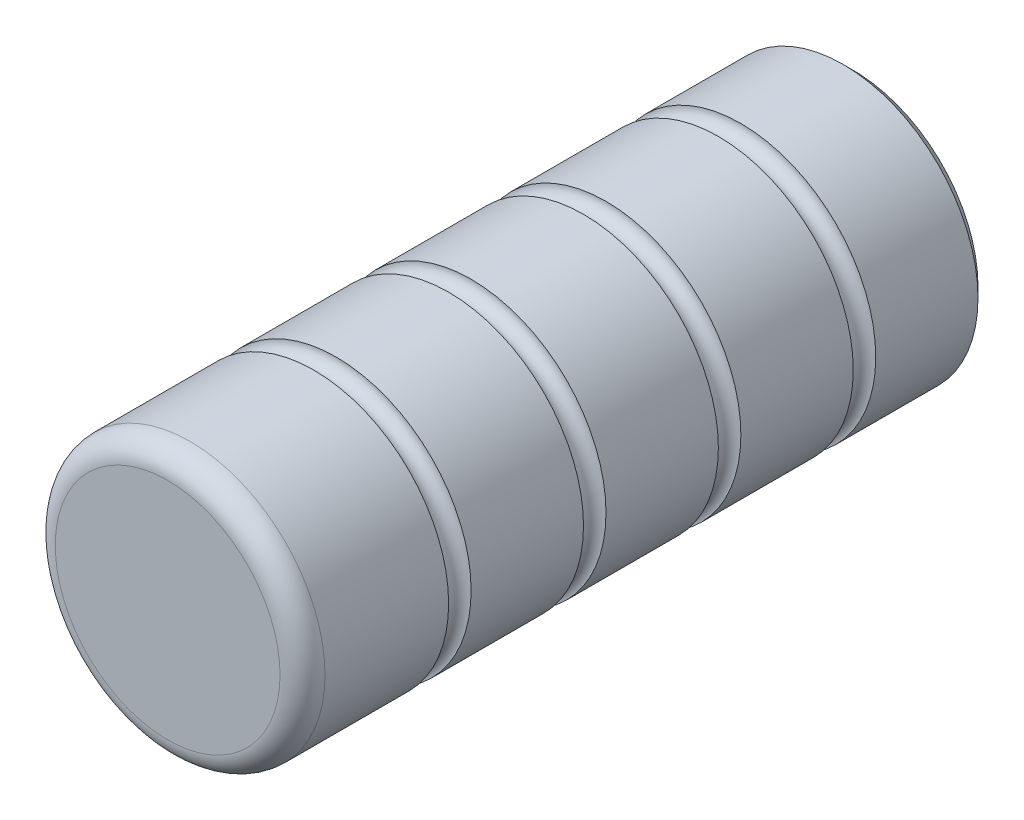
from build123d import *

# Parameters (mm, degrees)
ESBO_O1_R                = 6
RESSALTO_EXTRUS_O1_DEPTH = 30.5
ESBO_O2_R                = 3.175
CORTE_EXTRUS_O1_DEPTH    = 10
FILETE1_R                = 1
ESBO_O3_R                = 0.5
CHANFRO1_SIZE            = 0.45


with BuildPart() as part:
    # Esboço1 → Ressalto-extrusão1 (new body)
    with BuildSketch(Plane.XY):
        with Locations(Location((0, 0, 0), (0, 0, 180))):
            Circle(ESBO_O1_R)
    extrude(amount=RESSALTO_EXTRUS_O1_DEPTH)

    # Esboço2 → Corte-extrusão1 (cut)
    with BuildSketch(Plane(origin=(0, 0, 0), x_dir=(-1, 0, 0), z_dir=(0, 0, -1))):
        Circle(ESBO_O2_R)
    extrude(amount=-CORTE_EXTRUS_O1_DEPTH, mode=Mode.SUBTRACT)

    # Filete1
    filete1_edges = [part.edges().sort_by_distance(p)[0] for p in [
        (6, 0, 30.5),
    ]]
    fillet(filete1_edges, radius=FILETE1_R)

    # Esboço3 → Corte-Revolução1 (revolve, cut)
    with BuildSketch(Plane(origin=(0, 0, 0), x_dir=(1, 0, 0), z_dir=(0, 1, 0))):
        with Locations((-6, -23.5)):
            Circle(ESBO_O3_R)
        with Locations((-6, -17.5)):
            Circle(ESBO_O3_R)
        with Locations((-6, -5.5)):
            Circle(ESBO_O3_R)
        with Locations((-6, -11.5)):
            Circle(ESBO_O3_R)
    revolve(axis=Axis((0, 0, 0), (0, 0, 1)), mode=Mode.SUBTRACT)

    # Chanfro1
    chanfro1_edges = [part.edges().sort_by_distance(p)[0] for p in [
        (6, 0, 0),
    ]]
    chamfer(chanfro1_edges, length=CHANFRO1_SIZE)


solid = part.part
